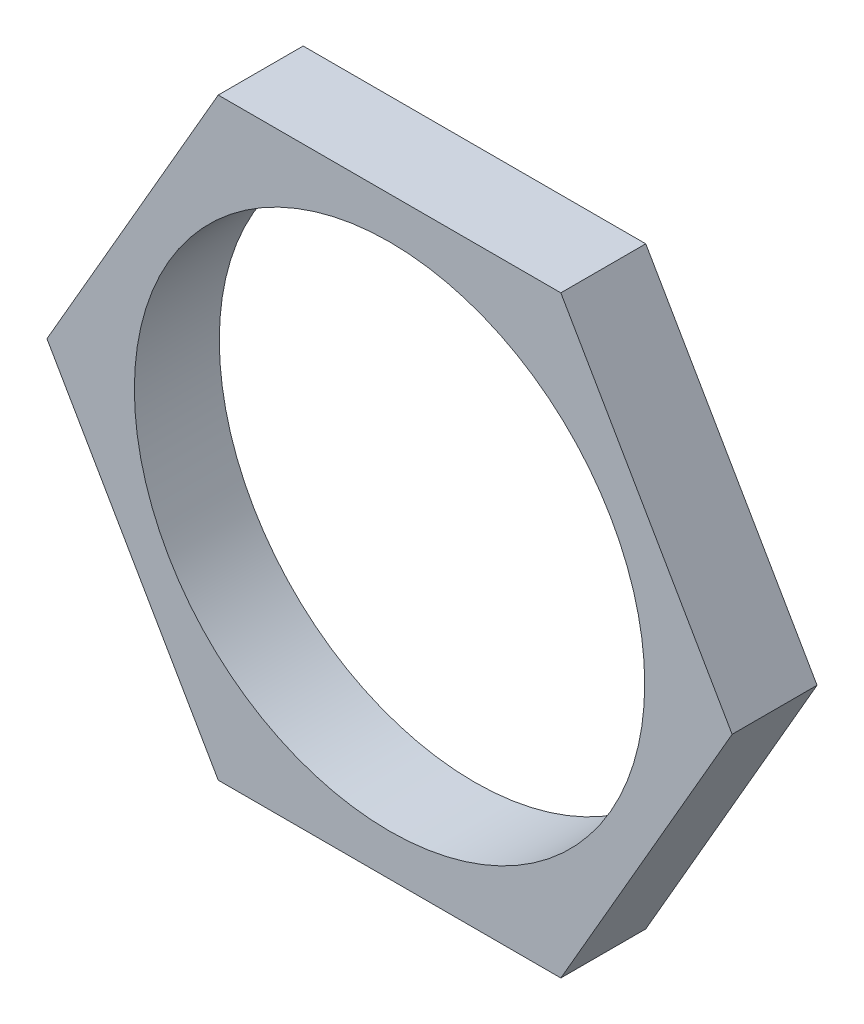
from build123d import *

# Parameters (mm, degrees)
SKETCH1_R           = 5.953125
BOSS_EXTRUDE1_DEPTH = 0.9906


with BuildPart() as part:
    # Sketch1 → Boss-Extrude1 (new, symmetric)
    with BuildSketch(Plane.XY):
        Polygon((3.996129888, -6.9215), (7.992259776, 0), (3.996129888, 6.9215), (-3.996129888, 6.9215), (-7.992259776, 0), (-3.996129888, -6.9215), align=None)
        Circle(SKETCH1_R, mode=Mode.SUBTRACT)
    extrude(amount=BOSS_EXTRUDE1_DEPTH, both=True)


solid = part.part
